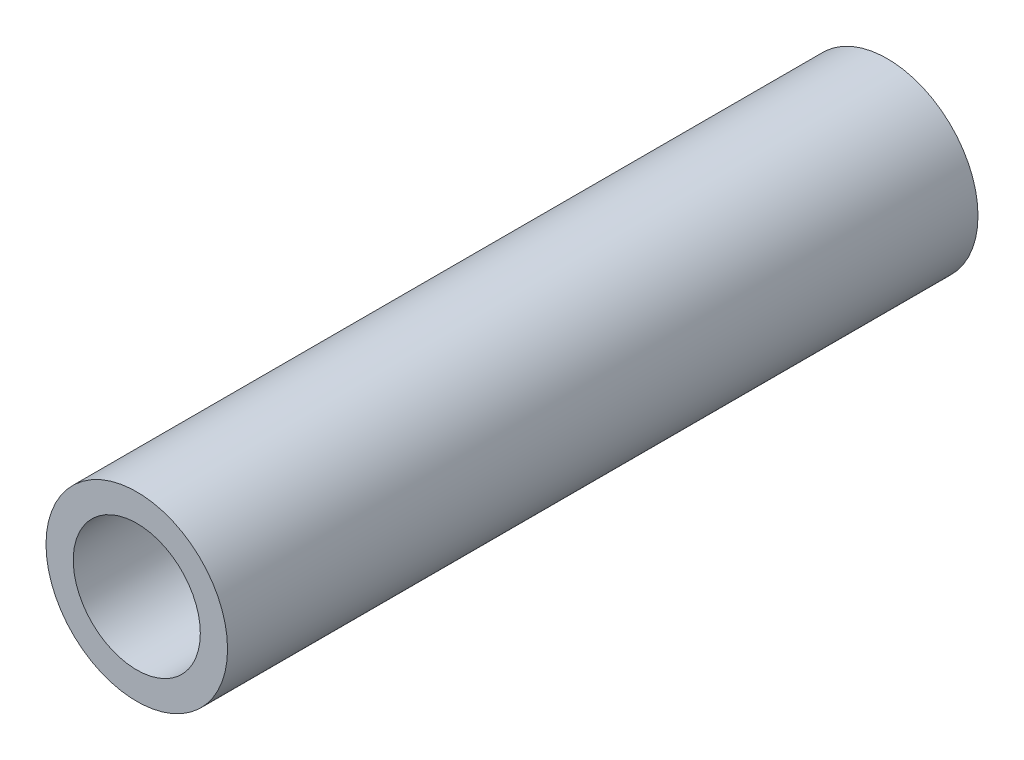
from build123d import *

# Parameters (mm, degrees)
CROQUIS1_R              = 3.75
CROQUIS1_R_2            = 2.625
SALIENTE_EXTRUIR1_DEPTH = 31


with BuildPart() as part:
    # Croquis1 → Saliente-Extruir1 (new body)
    with BuildSketch(Plane.XY):
        Circle(CROQUIS1_R)
        Circle(CROQUIS1_R_2, mode=Mode.SUBTRACT)
    extrude(amount=-SALIENTE_EXTRUIR1_DEPTH)


solid = part.part
